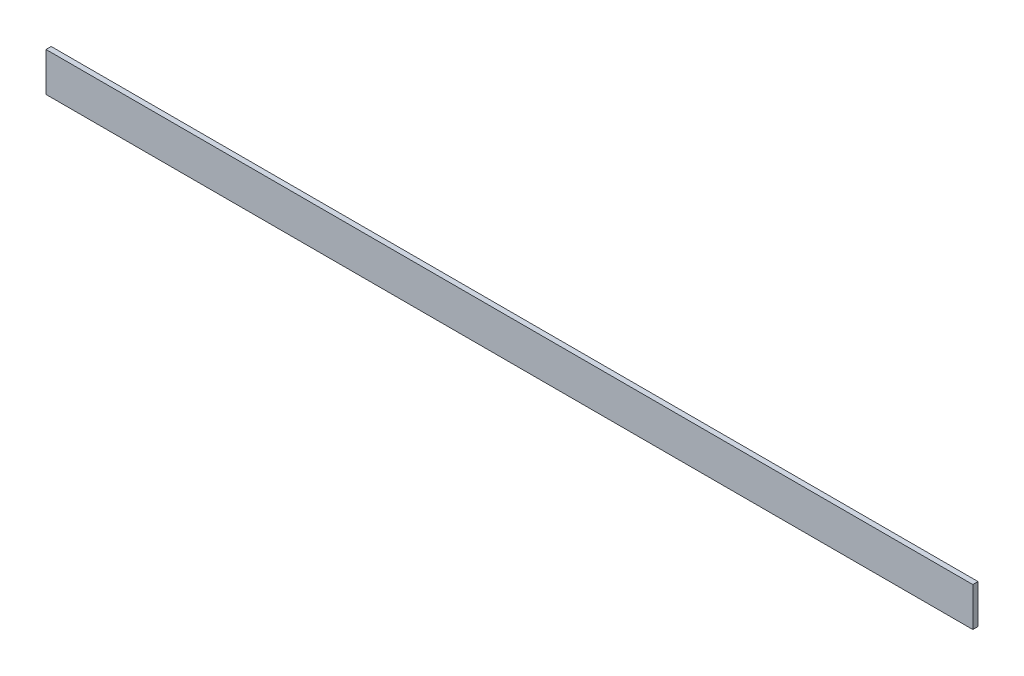
from build123d import *

# Parameters (mm, degrees)
SKETCH1_W           = 713.52
SKETCH1_H           = 30
BOSS_EXTRUDE1_DEPTH = 4


with BuildPart() as part:
    # Sketch1 → Boss-Extrude1 (new body)
    with BuildSketch(Plane.XY):
        Rectangle(SKETCH1_W, SKETCH1_H)
    extrude(amount=BOSS_EXTRUDE1_DEPTH)


solid = part.part
